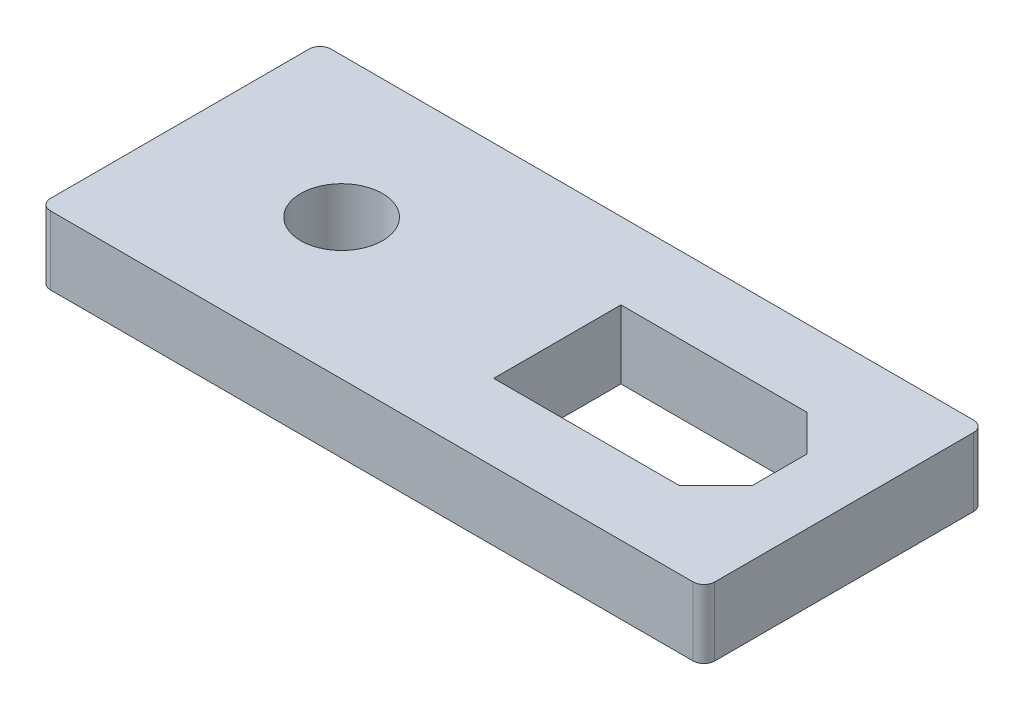
from build123d import *

# Parameters (mm, degrees)
SKETCH1_W           = 30.8
SKETCH1_H           = 13
SKETCH1_R           = 1.89865
BOSS_EXTRUDE1_DEPTH = 3.175
FILLET1_R           = 0.5


with BuildPart() as part:
    # Sketch1 → Boss-Extrude1 (new body)
    with BuildSketch(Plane(origin=(0, 0, 0), x_dir=(1, 0, 0), z_dir=(0, 1, 0))):
        with Locations((15.4, 6.5)):
            Rectangle(SKETCH1_W, SKETCH1_H)
        with Locations(Location((7.5, 6.5, 0), (0, 0, 270))):
            Circle(SKETCH1_R, mode=Mode.SUBTRACT)
        Polygon((27.8, 5.229289322), (27.8, 7.770710678), (26.120710678, 9.45), (17.5, 9.45), (17.5, 3.55), (26.120710678, 3.55), align=None, mode=Mode.SUBTRACT)
    extrude(amount=BOSS_EXTRUDE1_DEPTH)

    # Fillet1
    fillet1_edges = [part.edges().sort_by_distance(p)[0] for p in [
        (0, 1.5875, -13),
        (30.8, 1.5875, -13),
        (30.8, 1.5875, 0),
        (0, 1.5875, 0),
    ]]
    fillet(fillet1_edges, radius=FILLET1_R)


solid = part.part
